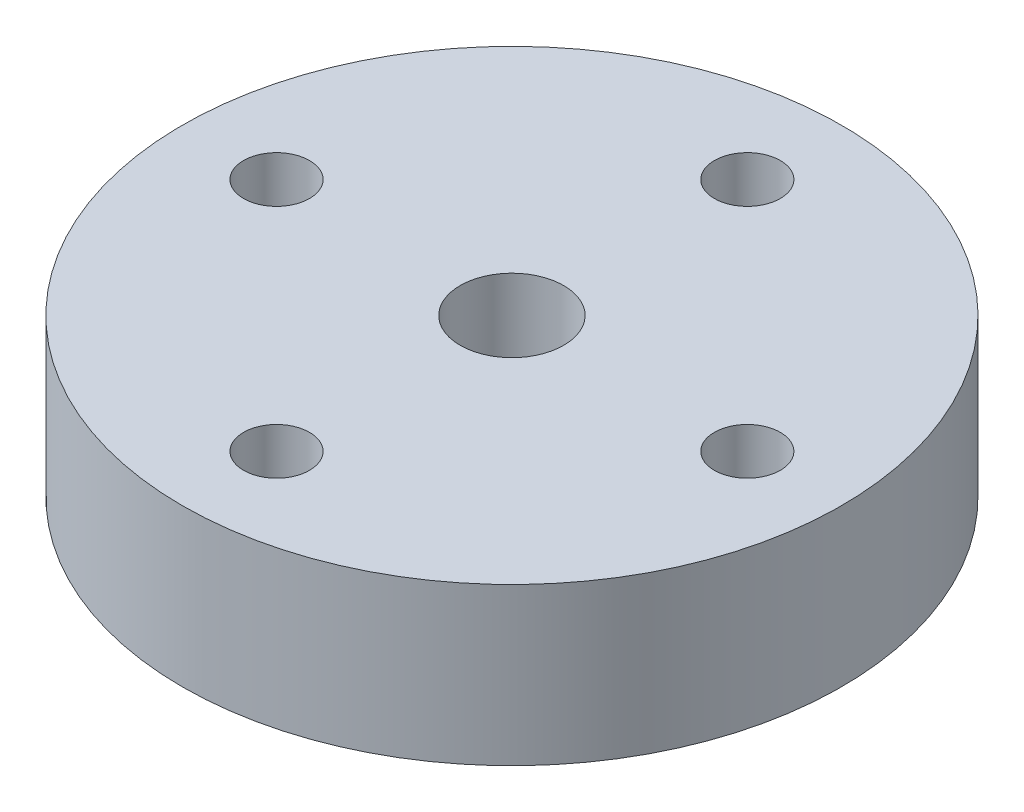
from build123d import *

# Parameters (mm, degrees)
SKETCH1_R           = 10.5
SKETCH1_R_2         = 1.65
SKETCH1_R_3         = 1.05
BOSS_EXTRUDE1_DEPTH = 5


with BuildPart() as part:
    # Sketch1 → Boss-Extrude1 (new body)
    with BuildSketch(Plane(origin=(0, 0, 0), x_dir=(1, 0, 0), z_dir=(0, 1, 0))):
        with Locations(Location((0, 0, 0), (0, 0, 270))):
            Circle(SKETCH1_R)
        with Locations(Location((0, 0, 0), (0, 0, 270))):
            Circle(SKETCH1_R_2, mode=Mode.SUBTRACT)
        with Locations(Location((-7.5, 0, 0), (0, 0, 270))):
            Circle(SKETCH1_R_3, mode=Mode.SUBTRACT)
        with Locations(Location((0, 7.5, 0), (0, 0, 270))):
            Circle(SKETCH1_R_3, mode=Mode.SUBTRACT)
        with Locations(Location((7.5, 0, 0), (0, 0, 270))):
            Circle(SKETCH1_R_3, mode=Mode.SUBTRACT)
        with Locations(Location((0, -7.5, 0), (0, 0, 270))):
            Circle(SKETCH1_R_3, mode=Mode.SUBTRACT)
    extrude(amount=BOSS_EXTRUDE1_DEPTH)


solid = part.part
